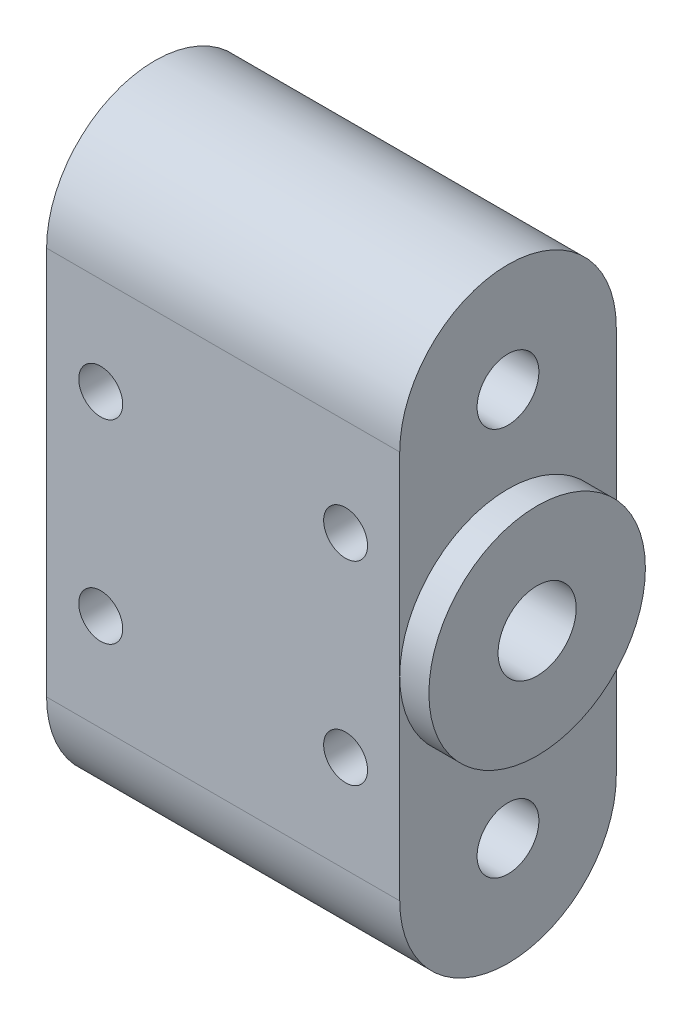
from build123d import *

# Parameters (mm, degrees)
BOSS_EXTRUDE1_DEPTH                  = 23.075011
SKETCH8_R                            = 7.0739
BOSS_EXTRUDE2_DEPTH                  = 1.905
F_1_4_20_TAPPED_HOLE1_D              = 5.1054
F_10_32_TAPPED_HOLE1_D               = 4.0386
F_6_40_TAPPED_HOLE1_D                = 2.8702
F_13_64_0_20313_DIAMETER_HOLE1_D     = 5.159502
F_13_64_0_20313_DIAMETER_HOLE1_DEPTH = 3.175
F_13_64_0_20313_DIAMETER_HOLE1_TIP   = 1.550070783


with BuildPart() as part:
    # Sketch1 → Boss-Extrude1 (new body)
    with BuildSketch(Plane(origin=(0, 0, 0), x_dir=(0, 0, -1), z_dir=(1, 0, 0))):
        with BuildLine():
            Line((7.0739, 12.7), (7.0739, -12.7))
            ThreePointArc((7.0739, -12.7), (0, -19.7739), (-7.0739, -12.7))
            Line((-7.0739, -12.7), (-7.0739, 12.7))
            ThreePointArc((-7.0739, 12.7), (0, 19.7739), (7.0739, 12.7))
        make_face()
    extrude(amount=BOSS_EXTRUDE1_DEPTH)

    # Sketch8 → Boss-Extrude2 (add)
    with BuildSketch(Plane(origin=(23.075011, 0, 0), x_dir=(0, 0, -1), z_dir=(1, 0, 0))):
        Circle(SKETCH8_R)
    extrude(amount=BOSS_EXTRUDE2_DEPTH)

    # 1/4-20 Tapped Hole1 (through all)
    with Locations(Plane(origin=(24.980011, 0, 0), x_dir=(0, 0, -1), z_dir=(1, 0, 0))):
        with Locations((0, 0)):
            Hole(F_1_4_20_TAPPED_HOLE1_D / 2)

    # #10-32 Tapped Hole1 (through all)
    with Locations(Plane(origin=(23.075011, 0, 0), x_dir=(0, 0, -1), z_dir=(1, 0, 0))):
        with Locations((0, 12.7), (0, -12.7)):
            Hole(F_10_32_TAPPED_HOLE1_D / 2)

    # #6-40 Tapped Hole1 (through all)
    with Locations(Plane.XY.offset(7.0739)):
        with Locations((3.5375055, 6.35), (19.5375055, 6.35), (3.5375055, -6.35), (19.5375055, -6.35)):
            Hole(F_6_40_TAPPED_HOLE1_D / 2)

    # 13/64 (0.20313) Diameter Hole1
    with Locations(Plane.ZY):
        with Locations((0, -12.7), (0, 12.7)):
            Hole(F_13_64_0_20313_DIAMETER_HOLE1_D / 2, depth=F_13_64_0_20313_DIAMETER_HOLE1_DEPTH)
            with Locations((0, 0, -(F_13_64_0_20313_DIAMETER_HOLE1_DEPTH + F_13_64_0_20313_DIAMETER_HOLE1_TIP / 2))):  # 118° drill point
                Cone(0, F_13_64_0_20313_DIAMETER_HOLE1_D / 2, F_13_64_0_20313_DIAMETER_HOLE1_TIP, mode=Mode.SUBTRACT)


solid = part.part
